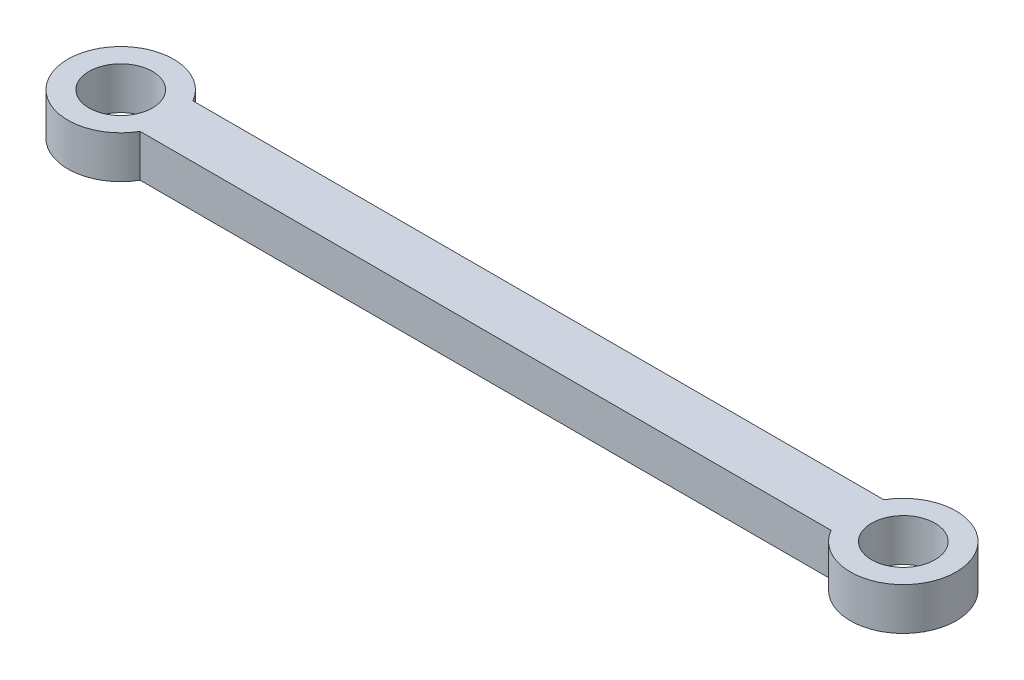
from build123d import *

# Parameters (mm, degrees)
SKETCH1_R           = 1.5
BOSS_EXTRUDE2_DEPTH = 2


with BuildPart() as part:
    # Sketch1 → Boss-Extrude2 (new body)
    with BuildSketch(Plane(origin=(0, 0, 0), x_dir=(1, 0, 0), z_dir=(0, 1, 0))):
        with BuildLine():
            Line((-9.623261093, 9.68272303), (23.046611888, 9.68272303))
            ThreePointArc((23.046611888, 9.68272303), (27.711675397, 8.43272303), (23.046611888, 7.18272303))
            Line((23.046611888, 7.18272303), (-9.623261093, 7.18272303))
            ThreePointArc((-9.623261093, 7.18272303), (-14.288324603, 8.43272303), (-9.623261093, 9.68272303))
        make_face()
        with Locations(Location((25.211675397, 8.43272303, 0), (0, 0, 270))):
            Circle(SKETCH1_R, mode=Mode.SUBTRACT)
        with Locations(Location((-11.788324603, 8.43272303, 0), (0, 0, 270))):
            Circle(SKETCH1_R, mode=Mode.SUBTRACT)
    extrude(amount=BOSS_EXTRUDE2_DEPTH)


solid = part.part
